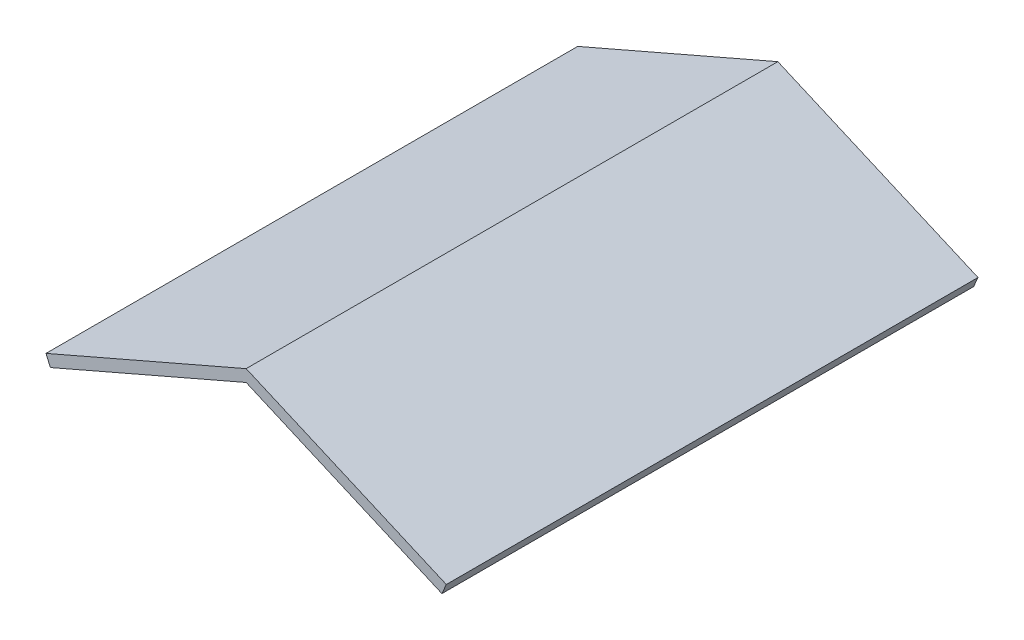
from build123d import *

# Parameters (mm, degrees)
EXTRUDE_1_DEPTH      = 14000
EXTRUDE_1_DEPTH_BACK = 500


with BuildPart() as part:
    # Эскиз1 → Бобышка-Вытянуть1 (new, two sides: drawn at the far end of the back side and taken through both)
    with BuildSketch(Plane.XY.offset(-EXTRUDE_1_DEPTH_BACK)):
        Polygon((-10177.741577619, 2783.007225068), (-4838.87078881, 5100), (500, 2783.007225068), (619.433328071, 3058.208388122), (-4838.87078881, 5427.033501608), (-10297.17490569, 3058.208388122), align=None)
    extrude(amount=EXTRUDE_1_DEPTH + EXTRUDE_1_DEPTH_BACK)


solid = part.part
